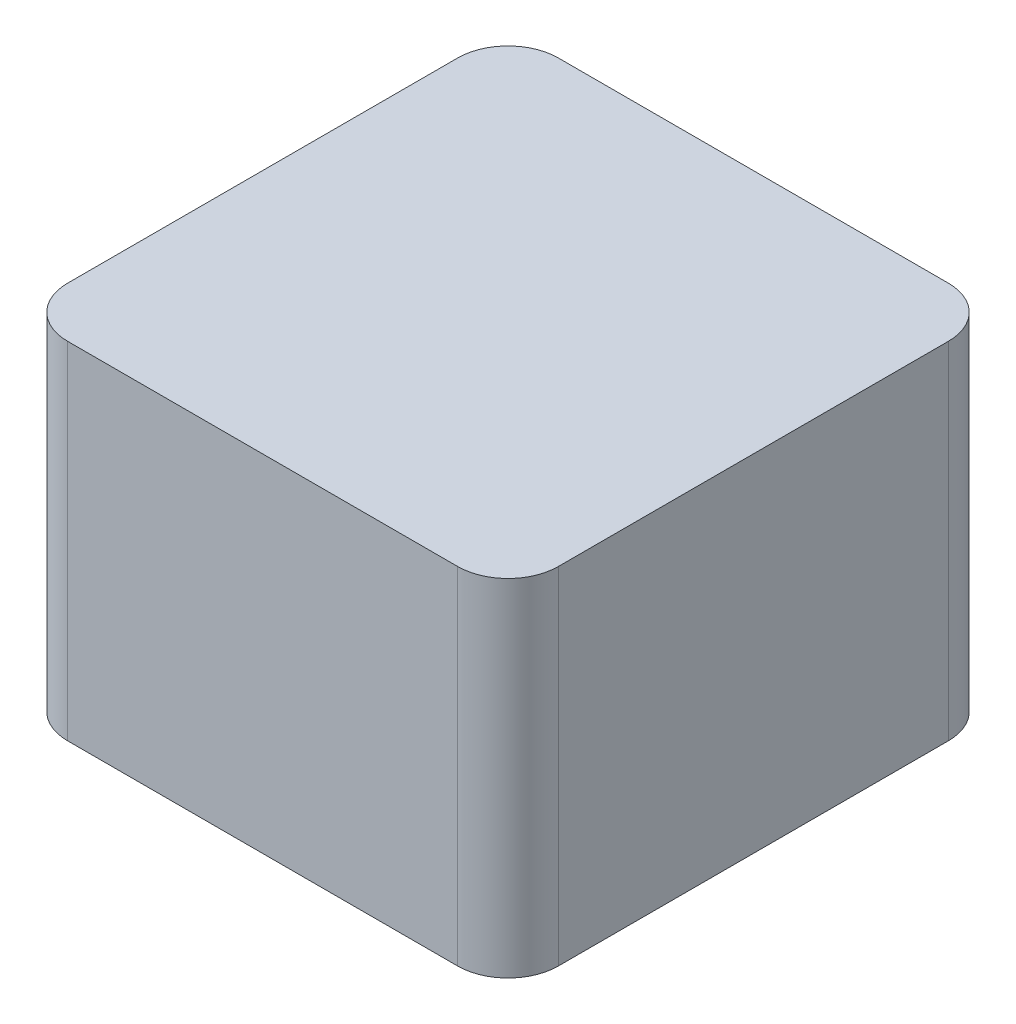
from build123d import *

# Parameters (mm, degrees)
BOSS_EXTRUDE1_START = 1
BOSS_EXTRUDE1_DEPTH = 5.5


with BuildPart() as part:
    # Sketch1 → Boss-Extrude1 (new body)
    with BuildSketch(Plane.XZ.offset(-123.724152422).offset(BOSS_EXTRUDE1_START)):
        with BuildLine():
            Line((80.976379089, 210.746126643), (80.976379089, 216.946126643))
            ThreePointArc((80.976379089, 216.946126643), (81.210693664, 217.511812068), (81.776379089, 217.746126643))
            Line((81.776379089, 217.746126643), (87.976379089, 217.746126643))
            ThreePointArc((87.976379089, 217.746126643), (88.542064514, 217.511812068), (88.776379089, 216.946126643))
            Line((88.776379089, 216.946126643), (88.776379089, 210.746126643))
            ThreePointArc((88.776379089, 210.746126643), (88.542064514, 210.180441218), (87.976379089, 209.946126643))
            Line((87.976379089, 209.946126643), (81.776379089, 209.946126643))
            ThreePointArc((81.776379089, 209.946126643), (81.210693664, 210.180441218), (80.976379089, 210.746126643))
        make_face()
    extrude(amount=-BOSS_EXTRUDE1_DEPTH)


solid = part.part
